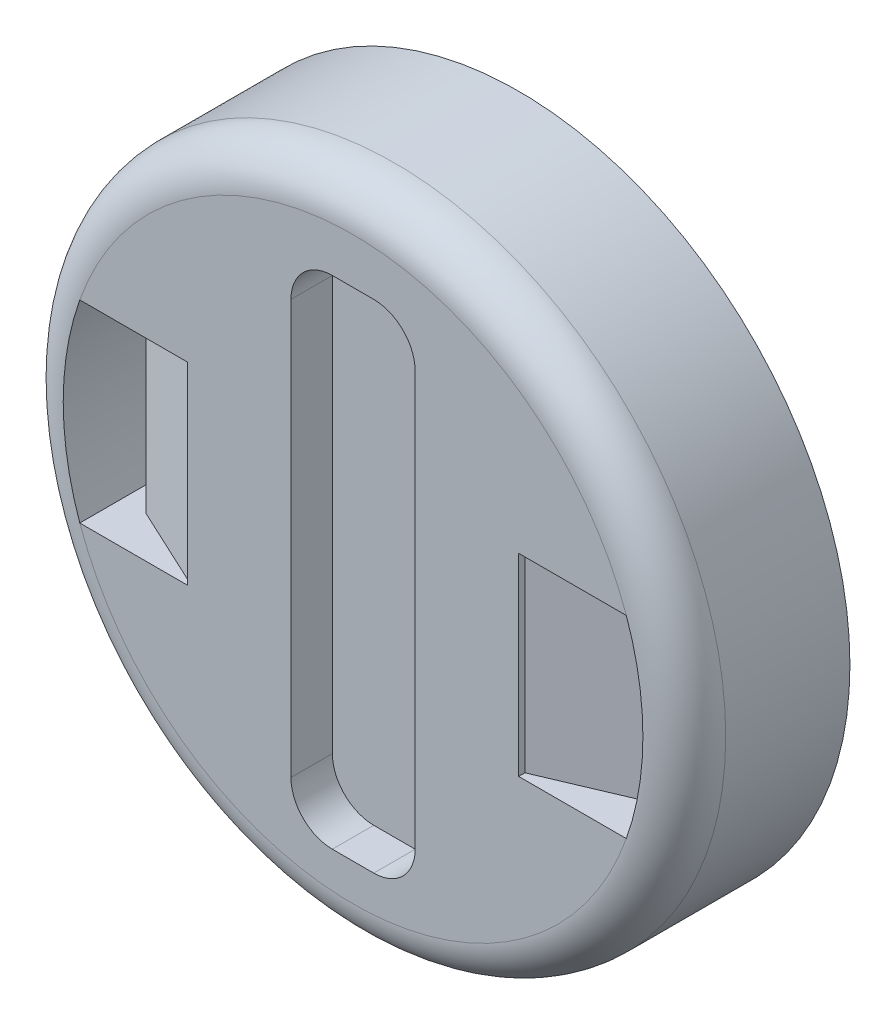
from build123d import *

# Parameters (mm, degrees)
SKETCH_1_R          = 8
EXTRUDE_1_DEPTH     = 4
FILLET_1_R          = 1
SKETCH_3_W          = 3
SKETCH_3_H          = 12
CUT_EXTRUDE_1_DEPTH = 1
FILLET_2_R          = 1
CUT_EXTRUDE_2_DEPTH = 1
CHAMFER_2_SIZE      = 2
CHAMFER_2_SIZE2     = 0.932615316
CHAMFER_5_SIZE      = 2
CHAMFER_5_SIZE2     = 0.848949632
CUT_EXTRUDE_3_DEPTH = 8
CUT_EXTRUDE_START   = -2
SKETCH_7_R          = 7
CUT_EXTRUDE_4_DEPTH = 2


with BuildPart() as part:
    # 草图1 → 凸台-拉伸1 (new body)
    with BuildSketch(Plane(origin=(0, 0, 12), x_dir=(-1, 0, 0), z_dir=(0, 0, -1))):
        Circle(SKETCH_1_R)
    extrude(amount=-EXTRUDE_1_DEPTH)

    # 圆角1
    fillet_1_edges = [part.edges().sort_by_distance(p)[0] for p in [
        (8, 0, 16),
    ]]
    fillet(fillet_1_edges, radius=FILLET_1_R)

    # 草图3 → 切除-拉伸1 (cut)
    with BuildSketch(Plane.XY.offset(16)):
        with Locations((0, -0.105406486)):
            Rectangle(SKETCH_3_W, SKETCH_3_H)
    extrude(amount=-CUT_EXTRUDE_1_DEPTH, mode=Mode.SUBTRACT)

    # 圆角2
    fillet_2_edges = [part.edges().sort_by_distance(p)[0] for p in [
        (-1.5, -6.105406486, 15.5),
        (-1.5, 5.894593514, 15.5),
        (1.5, 5.894593514, 15.5),
        (1.5, -6.105406486, 15.5),
    ]]
    fillet(fillet_2_edges, radius=FILLET_2_R)

    # 草图4 → 切除-拉伸2 (cut)
    with BuildSketch(Plane.XY.offset(16)):
        with BuildLine():
            Line((-6.599663291, 2.333333333), (-4, 2.333333333))
            Line((-4, 2.333333333), (-4, -2.333333333))
            Line((-4, -2.333333333), (-6.599663291, -2.333333333))
            ThreePointArc((-6.599663291, -2.333333333), (-7, 0), (-6.599663291, 2.333333333))
        make_face()
        with BuildLine():
            Line((4, -2.333333333), (6.599663291, -2.333333333))
            ThreePointArc((6.599663291, -2.333333333), (7, 0), (6.599663291, 2.333333333))
            Line((6.599663291, 2.333333333), (4, 2.333333333))
            Line((4, 2.333333333), (4, -2.333333333))
        make_face()
    extrude(amount=-CUT_EXTRUDE_2_DEPTH, mode=Mode.SUBTRACT)

    # 倒角2
    chamfer_2_edges = [part.edges().sort_by_distance(p)[0] for p in [
        (-4, 0, 15),
    ]]
    chamfer_2_side = [part.faces().sort_by_distance(p)[0] for p in [
        (-5.436521823, 0, 15),
    ]]
    chamfer(chamfer_2_edges, length=CHAMFER_2_SIZE, length2=CHAMFER_2_SIZE2, reference=chamfer_2_side[0])

    # 倒角5
    chamfer_5_edges = [part.edges().sort_by_distance(p)[0] for p in [
        (4, 0, 15),
    ]]
    chamfer_5_side = [part.faces().sort_by_distance(p)[0] for p in [
        (5.436521823, 0, 15),
    ]]
    chamfer(chamfer_5_edges, length=CHAMFER_5_SIZE, length2=CHAMFER_5_SIZE2, reference=chamfer_5_side[0])

    # 草图6 → 切除-拉伸3 (cut)
    with BuildSketch(Plane.XY.offset(15)):
        with BuildLine():
            Line((-6.599663291, -2.333333333), (-6, -2.333333333))
            Line((-6, -2.333333333), (-6, 2.333333333))
            Line((-6, 2.333333333), (-6.599663291, 2.333333333))
            ThreePointArc((-6.599663291, 2.333333333), (-7, 0), (-6.599663291, -2.333333333))
        make_face()
        with BuildLine():
            Line((6.599663291, 2.333333333), (6, 2.333333333))
            Line((6, 2.333333333), (6, -2.333333333))
            Line((6, -2.333333333), (6.599663291, -2.333333333))
            ThreePointArc((6.599663291, -2.333333333), (7, 0), (6.599663291, 2.333333333))
        make_face()
    extrude(amount=-CUT_EXTRUDE_3_DEPTH, mode=Mode.SUBTRACT)

    # 草图7 → 切除-拉伸4 (cut)
    with BuildSketch(Plane(origin=(0, 0, 12), x_dir=(-1, 0, 0), z_dir=(0, 0, -1)).offset(CUT_EXTRUDE_START)):
        Circle(SKETCH_7_R)
    extrude(amount=CUT_EXTRUDE_4_DEPTH, mode=Mode.SUBTRACT)


solid = part.part
